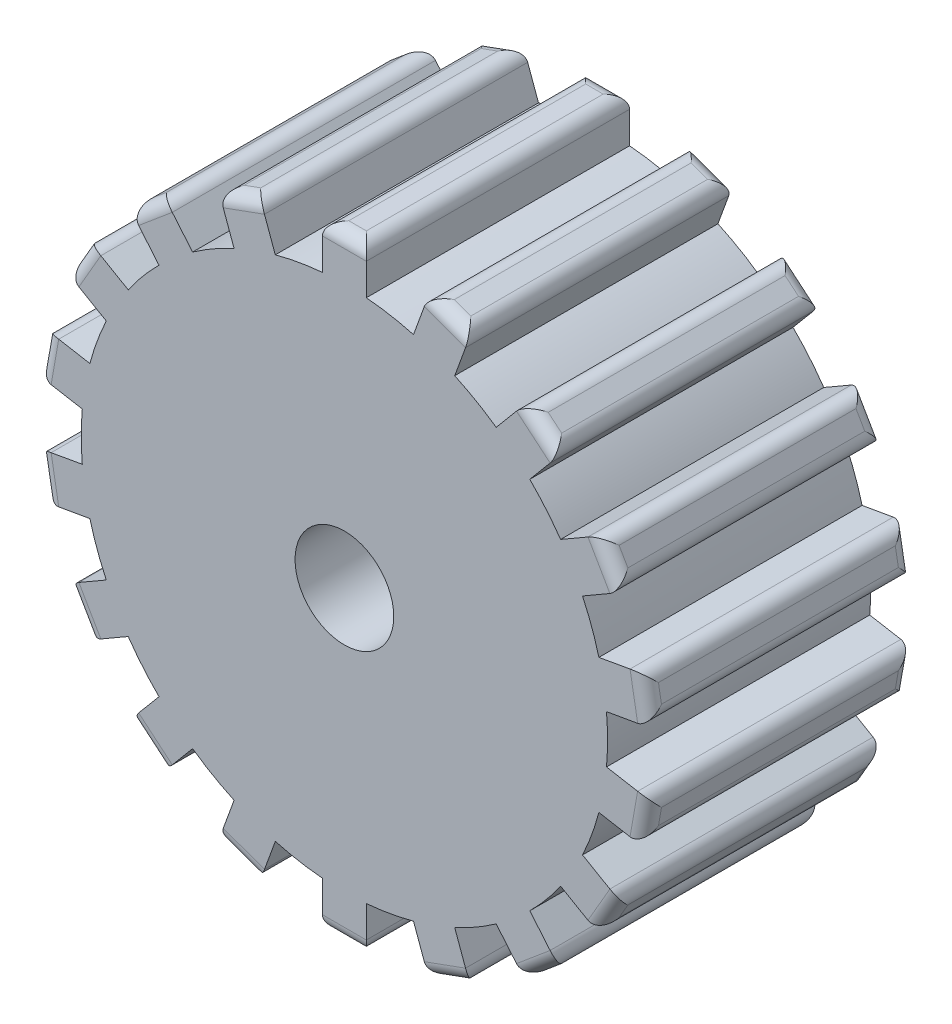
from build123d import *

# Parameters (mm, degrees)
SKETCH2_R                = 60
BOSS_EXTRUDE1_DEPTH      = 60
SKETCH3_W                = 10
SKETCH3_H                = 10.47851478
BOSS_EXTRUDE2_DEPTH      = 60
FILLET2_R                = 3
CIRPATTERN1_COUNT        = 18
FILLET2_OF_CIRPATTERN1_R = 3
SKETCH4_R                = 10
CUT_EXTRUDE1_DEPTH       = 60
SKETCH5_R                = 11.25
CUT_EXTRUDE2_DEPTH       = 60


with BuildPart() as part:
    # Sketch2 → Boss-Extrude1 (new body)
    with BuildSketch(Plane.XY):
        Circle(SKETCH2_R)
    extrude(amount=BOSS_EXTRUDE1_DEPTH)

    # Sketch3 → Boss-Extrude2 (add)
    with BuildSketch(Plane.XY.offset(60)):
        with Locations((0, 64.76074261)):
            Rectangle(SKETCH3_W, SKETCH3_H)
    boss_extrude2 = extrude(amount=-BOSS_EXTRUDE2_DEPTH)

    # Fillet2
    fillet2_edges = [part.edges().sort_by_distance(p)[0] for p in [
        (5, 70, 30),
        (0, 70, 0),
        (-5, 70, 30),
        (0, 70, 60),
    ]]
    fillet(fillet2_edges, radius=FILLET2_R)

    # CirPattern1: Boss-Extrude2 ×18 about axis
    cirpattern1_axis = Axis((0, 0, 0), (0, 0, 1))
    for i in range(1, CIRPATTERN1_COUNT):
        add(boss_extrude2.rotate(cirpattern1_axis, i * 360 / CIRPATTERN1_COUNT))

    # Fillet2 of CirPattern1
    fillet2_of_cirpattern1_edges = [part.edges().sort_by_distance(p)[0] for p in [
        (-19.242946929, 67.488584172, 30),
        (-23.941410033, 65.778483455, 0),
        (-28.639873137, 64.068382738, 30),
        (-23.941410033, 65.778483455, 60),
        (-41.164910462, 56.837049067, 30),
        (-44.995132678, 53.623111018, 0),
        (-48.825354894, 50.40917297, 30),
        (-44.995132678, 53.623111018, 60),
        (-58.121778265, 39.330127019, 30),
        (-60.621778265, 35, 0),
        (-63.121778265, 30.669872981, 30),
        (-60.621778265, 35, 60),
        (-68.068301823, 17.079411202, 30),
        (-68.936542711, 12.155372437, 0),
        (-69.804783599, 7.231333672, 30),
        (-68.936542711, 12.155372437, 60),
        (-69.804783599, -7.231333672, 30),
        (-68.936542711, -12.155372437, 0),
        (-68.068301823, -17.079411202, 30),
        (-68.936542711, -12.155372437, 60),
        (-63.121778265, -30.669872981, 30),
        (-60.621778265, -35, 0),
        (-58.121778265, -39.330127019, 30),
        (-60.621778265, -35, 60),
        (-48.825354894, -50.40917297, 30),
        (-44.995132678, -53.623111018, 0),
        (-41.164910462, -56.837049067, 30),
        (-44.995132678, -53.623111018, 60),
        (-28.639873137, -64.068382738, 30),
        (-23.941410033, -65.778483455, 0),
        (-19.242946929, -67.488584172, 30),
        (-23.941410033, -65.778483455, 60),
        (-5, -70, 30),
        (0, -70, 0),
        (5, -70, 30),
        (0, -70, 60),
        (19.242946929, -67.488584172, 30),
        (23.941410033, -65.778483455, 0),
        (28.639873137, -64.068382738, 30),
        (23.941410033, -65.778483455, 60),
        (41.164910462, -56.837049067, 30),
        (44.995132678, -53.623111018, 0),
        (48.825354894, -50.40917297, 30),
        (44.995132678, -53.623111018, 60),
        (58.121778265, -39.330127019, 30),
        (60.621778265, -35, 0),
        (63.121778265, -30.669872981, 30),
        (60.621778265, -35, 60),
        (68.068301823, -17.079411202, 30),
        (68.936542711, -12.155372437, 0),
        (69.804783599, -7.231333672, 30),
        (68.936542711, -12.155372437, 60),
        (69.804783599, 7.231333672, 30),
        (68.936542711, 12.155372437, 0),
        (68.068301823, 17.079411202, 30),
        (68.936542711, 12.155372437, 60),
        (63.121778265, 30.669872981, 30),
        (60.621778265, 35, 0),
        (58.121778265, 39.330127019, 30),
        (60.621778265, 35, 60),
        (48.825354894, 50.40917297, 30),
        (44.995132678, 53.623111018, 0),
        (41.164910462, 56.837049067, 30),
        (44.995132678, 53.623111018, 60),
        (28.639873137, 64.068382738, 30),
        (23.941410033, 65.778483455, 0),
        (19.242946929, 67.488584172, 30),
        (23.941410033, 65.778483455, 60),
    ]]
    fillet(fillet2_of_cirpattern1_edges, radius=FILLET2_OF_CIRPATTERN1_R)

    # Sketch4 → Cut-Extrude1 (cut)
    with BuildSketch(Plane.XY.offset(60)):
        Circle(SKETCH4_R)
    extrude(amount=-CUT_EXTRUDE1_DEPTH, mode=Mode.SUBTRACT)

    # Sketch5 → Cut-Extrude2 (cut)
    with BuildSketch(Plane(origin=(0, 0, 0), x_dir=(-1, 0, 0), z_dir=(0, 0, -1))):
        Circle(SKETCH5_R)
    extrude(amount=-CUT_EXTRUDE2_DEPTH, mode=Mode.SUBTRACT)


solid = part.part
